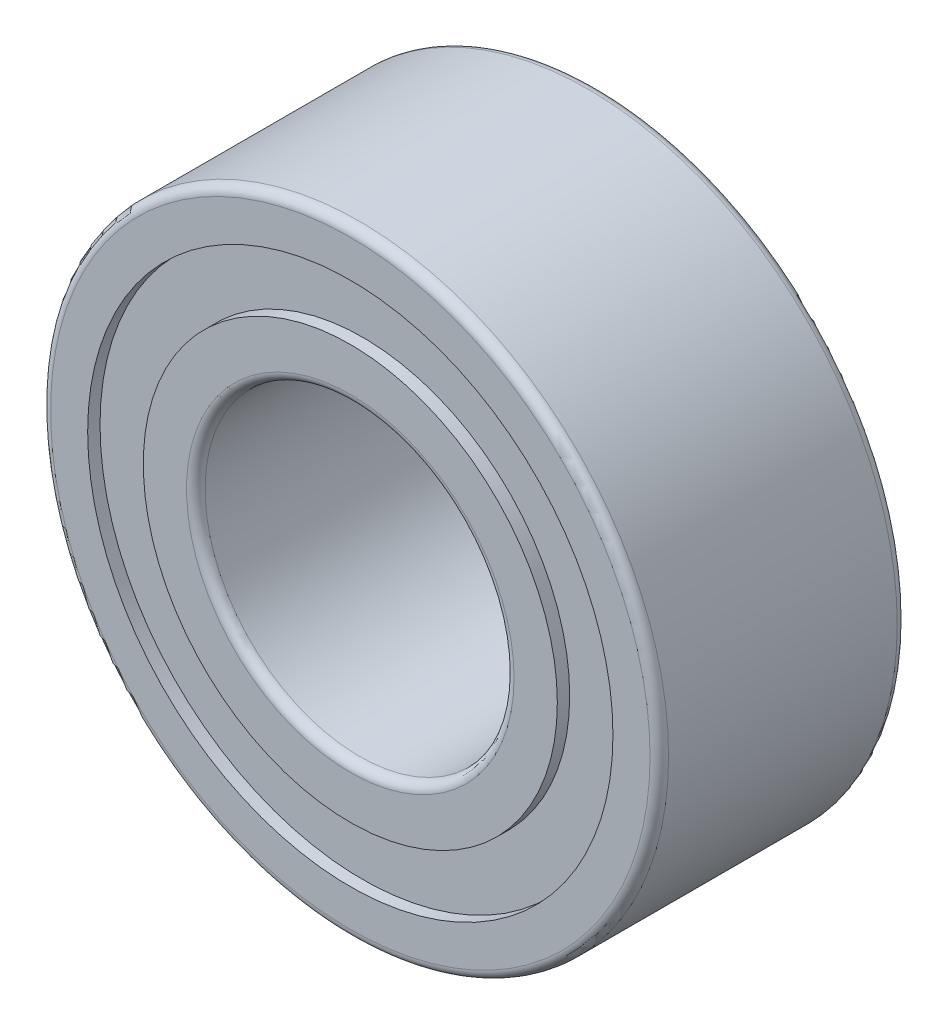
from build123d import *

# Parameters (mm, degrees)
SKETCH_1_R          = 5
SKETCH_1_R_2        = 2.5
EXTRUDE_1_DEPTH     = 2
SKETCH_2_R          = 4.25
SKETCH_2_R_2        = 3.35
CUT_EXTRUDE_2_DEPTH = 0.2
FILLET_1_R          = 0.15


with BuildPart() as part:
    # 草图1 → 拉伸1 (new, symmetric)
    with BuildSketch(Plane.XY):
        Circle(SKETCH_1_R)
        Circle(SKETCH_1_R_2, mode=Mode.SUBTRACT)
    extrude(amount=EXTRUDE_1_DEPTH, both=True)

    # 草图2 → 拉伸2 (cut)
    with BuildSketch(Plane.XY.offset(2)):
        Circle(SKETCH_2_R)
        Circle(SKETCH_2_R_2, mode=Mode.SUBTRACT)
    cut_extrude_2 = extrude(amount=-CUT_EXTRUDE_2_DEPTH, mode=Mode.SUBTRACT)

    # 镜向1: 拉伸2 across plane
    add(cut_extrude_2.mirror(Plane.XY), mode=Mode.SUBTRACT)

    # 圆角1
    fillet_1_edges = [part.edges().sort_by_distance(p)[0] for p in [
        (-5, 0, -2),
        (-5, 0, 2),
        (-2.5, 0, -2),
        (-2.5, 0, 2),
    ]]
    fillet(fillet_1_edges, radius=FILLET_1_R)


solid = part.part
